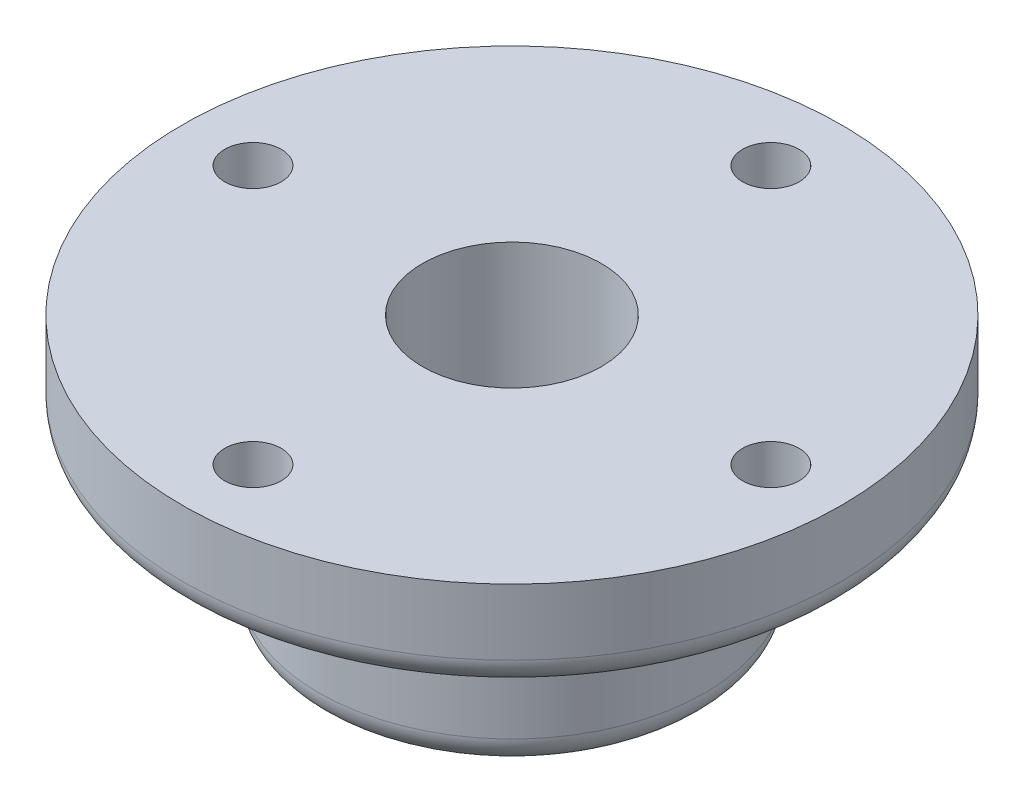
from build123d import *

# Parameters (mm, degrees)
SKETCH2_R          = 6
CUT_EXTRUDE1_DEPTH = 106.000000067


with BuildPart() as part:
    # Sketch1 → Revolve1 (revolve)
    with BuildSketch(Plane.XY):
        with BuildLine():
            Line((70, 27.5), (19, 27.5))
            Line((19, 27.5), (19, -27.5))
            Line((19, -27.5), (35, -27.5))
            ThreePointArc((35, -27.5), (39.242640687, -25.742640687), (41, -21.5))
            Line((41, -21.5), (41, 1.5))
            ThreePointArc((41, 1.5), (42.757359313, 5.742640687), (47, 7.5))
            Line((47, 7.5), (64, 7.5))
            ThreePointArc((64, 7.5), (68.242640687, 9.257359313), (70, 13.5))
            Line((70, 13.5), (70, 27.5))
        make_face()
    revolve(axis=Axis((0, -27.5, 0), (0, 1, 0)))

    # Sketch2 → Cut-Extrude1 (cut, through all)
    with BuildSketch(Plane.XZ.offset(-7.5)):
        with Locations((-55, 0)):
            Circle(SKETCH2_R)
        with Locations((0, 55)):
            Circle(SKETCH2_R)
        with Locations((55, 0)):
            Circle(SKETCH2_R)
        with Locations((0, -55)):
            Circle(SKETCH2_R)
    extrude(amount=-CUT_EXTRUDE1_DEPTH, mode=Mode.SUBTRACT)


solid = part.part
